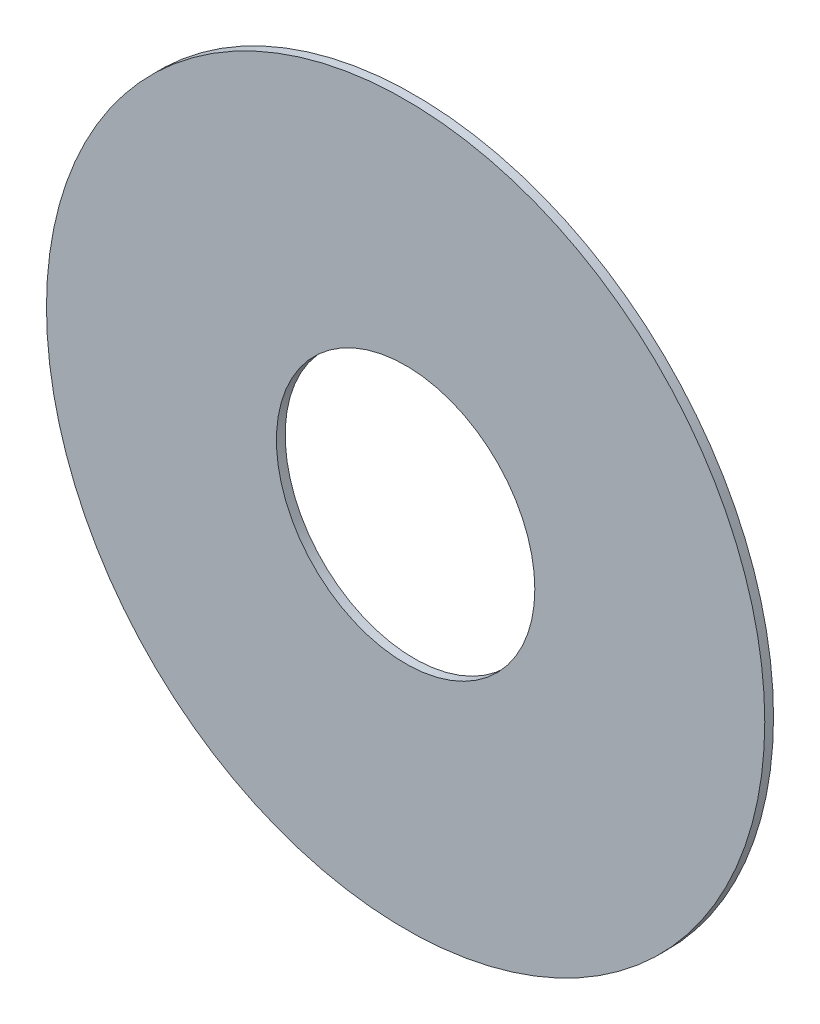
from build123d import *

# Parameters (mm, degrees)
PRINTED_GUARD_START = 40.5
SKETCH_1_R          = 82
SKETCH_1_R_2        = 29.5
PRINTED_GUARD_DEPTH = 2


with BuildPart() as part:
    # Эскиз1 → Printed_guard (new body)
    with BuildSketch(Plane.XY.offset(PRINTED_GUARD_START)):
        Circle(SKETCH_1_R)
        Circle(SKETCH_1_R_2, mode=Mode.SUBTRACT)
    extrude(amount=PRINTED_GUARD_DEPTH)


solid = part.part
